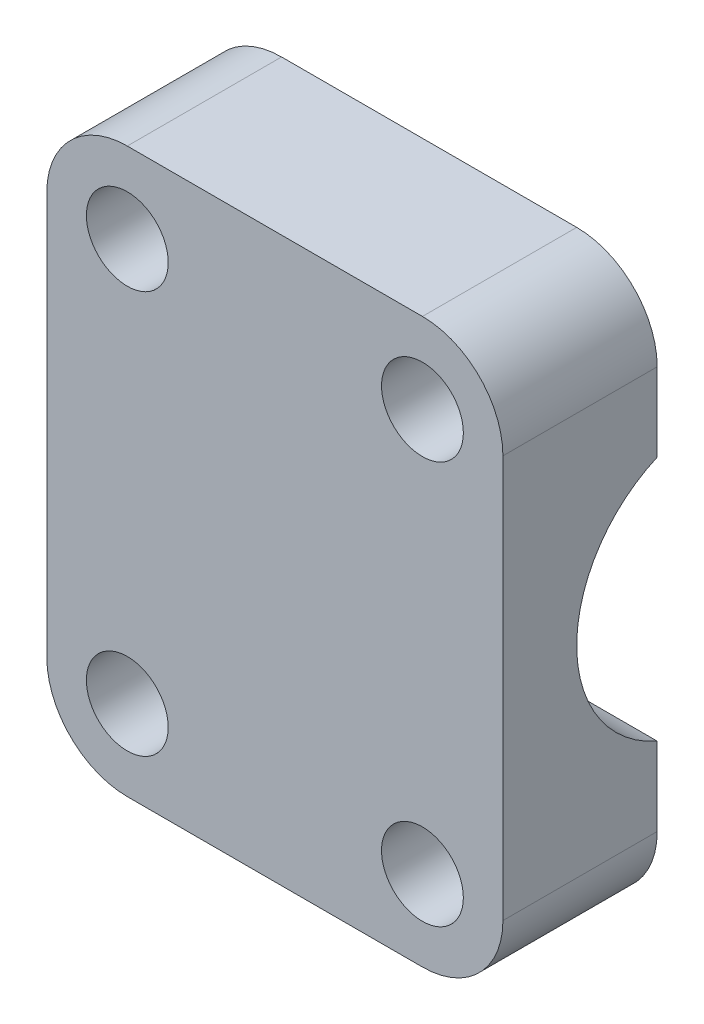
from build123d import *

# Parameters (mm, degrees)
EXTRUDE_START       = 2
SKETCH_1_W          = 17
SKETCH_1_H          = 21
SKETCH_1_R          = 1.525
EXTRUDE_1_DEPTH     = 5.75
SKETCH_2_R          = 5
CUT_EXTRUDE_2_DEPTH = 22.43157717
FILLET_1_R          = 3


with BuildPart() as part:
    # 草图1 → 凸台-拉伸1 (new body)
    with BuildSketch(Plane.XY.offset(EXTRUDE_START)):
        Rectangle(SKETCH_1_W, SKETCH_1_H)
        with Locations((-5.5, 7.5)):
            Circle(SKETCH_1_R, mode=Mode.SUBTRACT)
        with Locations((5.5, 7.5)):
            Circle(SKETCH_1_R, mode=Mode.SUBTRACT)
        with Locations((5.5, -7.5)):
            Circle(SKETCH_1_R, mode=Mode.SUBTRACT)
        with Locations((-5.5, -7.5)):
            Circle(SKETCH_1_R, mode=Mode.SUBTRACT)
    extrude(amount=EXTRUDE_1_DEPTH)

    # 草图2 → 切除-拉伸2 (cut, through all)
    with BuildSketch(Plane(origin=(8.5, 0, 0), x_dir=(0, 0, -1), z_dir=(1, 0, 0))):
        Circle(SKETCH_2_R)
    extrude(amount=-CUT_EXTRUDE_2_DEPTH, mode=Mode.SUBTRACT)

    # 圆角1
    fillet_1_edges = [part.edges().sort_by_distance(p)[0] for p in [
        (-8.5, 10.5, 4.875),
        (8.5, 10.5, 4.875),
        (8.5, -10.5, 4.875),
        (-8.5, -10.5, 4.875),
    ]]
    fillet(fillet_1_edges, radius=FILLET_1_R)


solid = part.part
